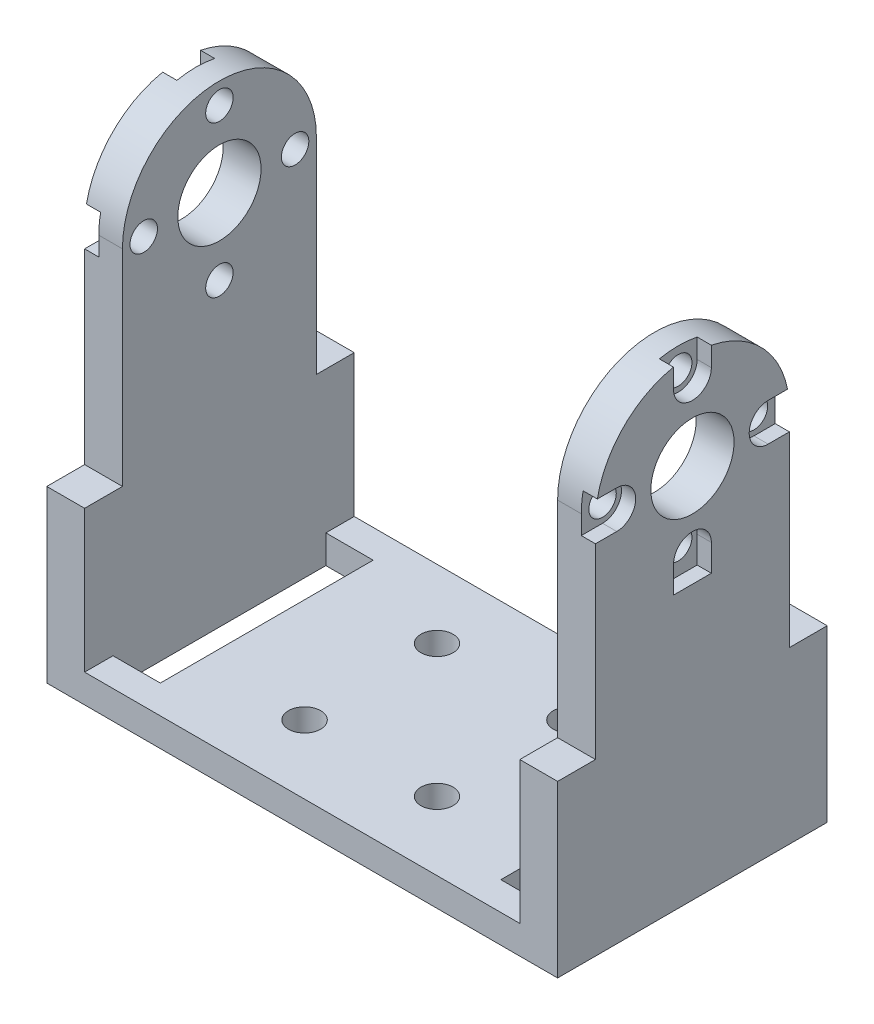
from build123d import *
from build123d.topology import SkipClean

# Parameters (mm, degrees)
SKETCH1_W           = 54
SKETCH1_H           = 28.5
SKETCH1_W_2         = 5
SKETCH1_H_2         = 22.5
SKETCH1_R           = 1.7
SKETCH1_R_2         = 7.5
BOSS_EXTRUDE2_DEPTH = 3
SKETCH2_W           = 4
SKETCH2_H           = 20.5
BOSS_EXTRUDE3_DEPTH = 21.75
SKETCH4_R           = 10.25
BOSS_EXTRUDE4_DEPTH = 4
SKETCH6_R           = 4.4
SKETCH6_R_2         = 1.45
CUT_EXTRUDE3_DEPTH  = 4
SKETCH7_R           = 1.45
CUT_EXTRUDE4_DEPTH  = 1.5
SKETCH8_W           = 28.781481152
SKETCH8_H           = 28.5
BOSS_EXTRUDE5_DEPTH = 3
SKETCH9_R           = 1.7
CUT_EXTRUDE5_DEPTH  = 3
SKETCH10_W          = 54
SKETCH10_H          = 28.5
SKETCH10_R          = 1.7
SKETCH10_W_2        = 5
SKETCH10_H_2        = 22.5
BOSS_EXTRUDE6_DEPTH = 15
SKETCH11_W          = 46
SKETCH11_H          = 15
CUT_EXTRUDE6_DEPTH  = 53.595151868


with BuildPart() as part:
    # Sketch1 → Boss-Extrude2 (new body)
    with BuildSketch(Plane(origin=(0, 0, 0), x_dir=(1, 0, 0), z_dir=(0, 1, 0))):
        Rectangle(SKETCH1_W, SKETCH1_H)
        with Locations((20.5, 0)):
            Rectangle(SKETCH1_W_2, SKETCH1_H_2, mode=Mode.SUBTRACT)
        with Locations((-20.5, 0)):
            Rectangle(SKETCH1_W_2, SKETCH1_H_2, mode=Mode.SUBTRACT)
        with Locations(Location((-9, -8.25, 0), (0, 0, 270))):
            Circle(SKETCH1_R, mode=Mode.SUBTRACT)
        with Locations(Location((9, -8.25, 0), (0, 0, 270))):
            Circle(SKETCH1_R, mode=Mode.SUBTRACT)
        with Locations(Location((-9, 8.25, 0), (0, 0, 270))):
            Circle(SKETCH1_R, mode=Mode.SUBTRACT)
        with Locations(Location((0, 0, 0), (0, 0, 270))):
            Circle(SKETCH1_R_2, mode=Mode.SUBTRACT)
        with Locations(Location((9, 8.25, 0), (0, 0, 270))):
            Circle(SKETCH1_R, mode=Mode.SUBTRACT)
    extrude(amount=BOSS_EXTRUDE2_DEPTH)

    # Sketch2 → Boss-Extrude3 (add)
    with BuildSketch(Plane(origin=(0, 3, 0), x_dir=(1, 0, 0), z_dir=(0, 1, 0))):
        with Locations((25, 0)):
            Rectangle(SKETCH2_W, SKETCH2_H)
    boss_extrude3 = extrude(amount=BOSS_EXTRUDE3_DEPTH)

    # Sketch4 → Boss-Extrude4 (add)
    with BuildSketch(Plane(origin=(27, 0, 0), x_dir=(0, 0, -1), z_dir=(1, 0, 0))):
        with Locations((0, 24.75)):
            Circle(SKETCH4_R)
    boss_extrude4 = extrude(amount=-BOSS_EXTRUDE4_DEPTH)

    # Mirror1: Boss-Extrude3, Boss-Extrude4 across plane
    add(boss_extrude3.mirror(Plane(origin=(0, 0, 0), x_dir=(0, 0, 1), z_dir=(1, 0, 0))))
    add(boss_extrude4.mirror(Plane(origin=(0, 0, 0), x_dir=(0, 0, 1), z_dir=(1, 0, 0))))

    # Sketch6 → Cut-Extrude3 (cut)
    with BuildSketch(Plane(origin=(27, 0, 0), x_dir=(0, 0, -1), z_dir=(1, 0, 0))):
        with Locations((0, 24.75)):
            Circle(SKETCH6_R)
        with Locations((0, 32.75)):
            Circle(SKETCH6_R_2)
        with Locations((8, 24.75)):
            Circle(SKETCH6_R_2)
        with Locations((0, 16.75)):
            Circle(SKETCH6_R_2)
        with Locations((-8, 24.75)):
            Circle(SKETCH6_R_2)
    cut_extrude3 = extrude(amount=-CUT_EXTRUDE3_DEPTH, mode=Mode.SUBTRACT)

    # Mirror3: Cut-Extrude3 across plane
    add(cut_extrude3.mirror(Plane(origin=(0, 0, 0), x_dir=(0, 0, 1), z_dir=(1, 0, 0))), mode=Mode.SUBTRACT)

    # Sketch7 → Cut-Extrude4 (cut)
    # profile 1 of 4: a face of its own
    with BuildSketch(Plane(origin=(27, 0, 0), x_dir=(0, 0, -1), z_dir=(1, 0, 0))):
        with BuildLine():
            ThreePointArc((10.25, 24.75), (10.200627247, 25.754840168), (10.052984631, 26.75))
            Line((10.052984631, 26.75), (8, 26.75))
            ThreePointArc((8, 26.75), (6, 24.75), (8, 22.75))
            Line((8, 22.75), (10.25, 22.75))
            Line((10.25, 22.75), (10.25, 24.75))
        make_face()
        with Locations((8, 24.75)):
            Circle(SKETCH7_R, mode=Mode.SUBTRACT)
    # profile 2 of 4: a face of its own
    with BuildSketch(Plane(origin=(27, 0, 0), x_dir=(0, 0, -1), z_dir=(1, 0, 0))):
        with BuildLine():
            Line((2, 32.75), (2, 34.802984631))
            ThreePointArc((2, 34.802984631), (0, 35), (-2, 34.802984631))
            Line((-2, 34.802984631), (-2, 32.75))
            ThreePointArc((-2, 32.75), (0, 30.75), (2, 32.75))
        make_face()
        with Locations((0, 32.75)):
            Circle(SKETCH7_R, mode=Mode.SUBTRACT)
    # profile 3 of 4: a face of its own
    with BuildSketch(Plane(origin=(27, 0, 0), x_dir=(0, 0, -1), z_dir=(1, 0, 0))):
        with BuildLine():
            Line((-8, 26.75), (-10.052984631, 26.75))
            ThreePointArc((-10.052984631, 26.75), (-10.200627247, 25.754840168), (-10.25, 24.75))
            Line((-10.25, 24.75), (-10.25, 22.75))
            Line((-10.25, 22.75), (-8, 22.75))
            ThreePointArc((-8, 22.75), (-6, 24.75), (-8, 26.75))
        make_face()
        with Locations((-8, 24.75)):
            Circle(SKETCH7_R, mode=Mode.SUBTRACT)
    # profile 4 of 4: a face of its own
    with BuildSketch(Plane(origin=(27, 0, 0), x_dir=(0, 0, -1), z_dir=(1, 0, 0))):
        with BuildLine():
            Line((-2, 16.75), (-2, 13.927640071))
            Line((-2, 13.927640071), (2, 13.927640071))
            Line((2, 13.927640071), (2, 16.75))
            ThreePointArc((2, 16.75), (0, 18.75), (-2, 16.75))
        make_face()
        with Locations((0, 16.75)):
            Circle(SKETCH7_R, mode=Mode.SUBTRACT)
    cut_extrude4 = extrude(amount=-CUT_EXTRUDE4_DEPTH, mode=Mode.SUBTRACT)

    # Mirror4: Cut-Extrude4 across plane
    add(cut_extrude4.mirror(Plane(origin=(0, 0, 0), x_dir=(0, 0, 1), z_dir=(1, 0, 0))), mode=Mode.SUBTRACT)

    # Sketch8 → Boss-Extrude5 (add)
    with BuildSketch(Plane(origin=(0, 3, 0), x_dir=(1, 0, 0), z_dir=(0, 1, 0))):
        Rectangle(SKETCH8_W, SKETCH8_H)
    extrude(amount=-BOSS_EXTRUDE5_DEPTH)

    # Sketch9 → Cut-Extrude5 (cut)
    with BuildSketch(Plane(origin=(0, 3, 0), x_dir=(1, 0, 0), z_dir=(0, 1, 0))):
        with BuildLine():
            ThreePointArc((-5.3, -7), (-5.797918472, -5.797918472), (-7, -5.3))
            Line((-7, -5.3), (-7, -7))
            Line((-7, -7), (-5.3, -7))
        make_face()
        with BuildLine():
            Line((-7, -7), (-7, -5.3))
            ThreePointArc((-7, -5.3), (-8.202081528, -8.202081528), (-5.3, -7))
            Line((-5.3, -7), (-7, -7))
        make_face()
        with BuildLine():
            ThreePointArc((8.7, -7), (8.202081528, -5.797918472), (7, -5.3))
            Line((7, -5.3), (7, -7))
            Line((7, -7), (5.3, -7))
            ThreePointArc((5.3, -7), (7, -8.7), (8.7, -7))
        make_face()
        with BuildLine():
            Line((7, -7), (7, -5.3))
            ThreePointArc((7, -5.3), (5.797918472, -5.797918472), (5.3, -7))
            Line((5.3, -7), (7, -7))
        make_face()
        with BuildLine():
            ThreePointArc((8.7, 7), (7, 8.7), (5.3, 7))
            Line((5.3, 7), (7, 7))
            Line((7, 7), (7, 5.3))
            ThreePointArc((7, 5.3), (8.202081528, 5.797918472), (8.7, 7))
        make_face()
        with BuildLine():
            Line((7, 7), (5.3, 7))
            ThreePointArc((5.3, 7), (5.797918472, 5.797918472), (7, 5.3))
            Line((7, 5.3), (7, 7))
        make_face()
        with Locations(Location((-7, 7, 0), (0, 0, 270))):
            Circle(SKETCH9_R)
    extrude(amount=-CUT_EXTRUDE5_DEPTH, mode=Mode.SUBTRACT)

    # Sketch10 → Boss-Extrude6 (add)
    with SkipClean():  # the faces are left unmerged after this step: merging them gives an invalid solid
        with BuildSketch(Plane.XZ):
            Rectangle(SKETCH10_W, SKETCH10_H)
            with Locations(Location((-7, 7, 0), (0, 0, 90))):
                Circle(SKETCH10_R, mode=Mode.SUBTRACT)
            with Locations(Location((-7, -7, 0), (0, 0, 90))):
                Circle(SKETCH10_R, mode=Mode.SUBTRACT)
            with Locations(Location((7, -7, 0), (0, 0, 90))):
                Circle(SKETCH10_R, mode=Mode.SUBTRACT)
            with Locations(Location((7, 7, 0), (0, 0, 90))):
                Circle(SKETCH10_R, mode=Mode.SUBTRACT)
            with Locations((-20.5, 0)):
                Rectangle(SKETCH10_W_2, SKETCH10_H_2, mode=Mode.SUBTRACT)
            with Locations((20.5, 0)):
                Rectangle(SKETCH10_W_2, SKETCH10_H_2, mode=Mode.SUBTRACT)
        extrude(amount=BOSS_EXTRUDE6_DEPTH)

    # Sketch11 → Cut-Extrude6 (cut, through all)
    with BuildSketch(Plane.XY.offset(14.25)):
        with Locations((0, -4.5)):
            Rectangle(SKETCH11_W, SKETCH11_H)
    extrude(amount=-CUT_EXTRUDE6_DEPTH, mode=Mode.SUBTRACT)


solid = part.part
